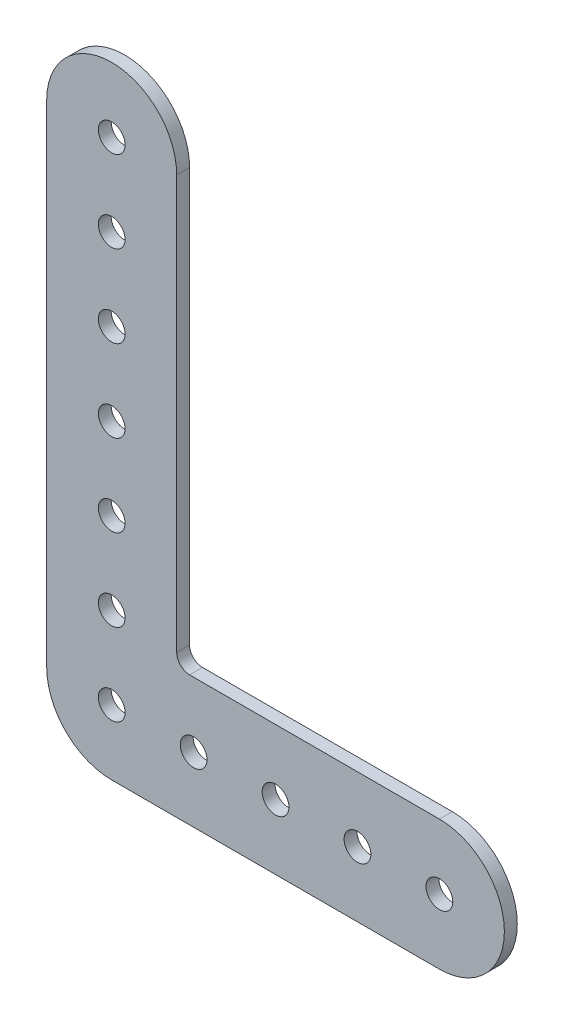
from build123d import *

# Parameters (mm, degrees)
SKETCH1_R           = 2.075
BOSS_EXTRUDE1_DEPTH = 1
FILLET1_R           = 2


with BuildPart() as part:
    # Sketch1 → Boss-Extrude1 (new, symmetric)
    with BuildSketch(Plane.XY):
        with BuildLine():
            Line((-10.075, 76.2), (-10.075, 0))
            ThreePointArc((-10.075, 0), (-7.12410082, -7.12410082), (0, -10.075))
            Line((0, -10.075), (50.8, -10.075))
            ThreePointArc((50.8, -10.075), (60.875, 0), (50.8, 10.075))
            Line((50.8, 10.075), (10.075, 10.075))
            Line((10.075, 10.075), (10.075, 76.2))
            ThreePointArc((10.075, 76.2), (0, 86.275), (-10.075, 76.2))
        make_face()
        Circle(SKETCH1_R, mode=Mode.SUBTRACT)
        with Locations((12.7, 0)):
            Circle(SKETCH1_R, mode=Mode.SUBTRACT)
        with Locations((25.4, 0)):
            Circle(SKETCH1_R, mode=Mode.SUBTRACT)
        with Locations((38.1, 0)):
            Circle(SKETCH1_R, mode=Mode.SUBTRACT)
        with Locations((50.8, 0)):
            Circle(SKETCH1_R, mode=Mode.SUBTRACT)
        with Locations((0, 12.7)):
            Circle(SKETCH1_R, mode=Mode.SUBTRACT)
        with Locations((0, 25.4)):
            Circle(SKETCH1_R, mode=Mode.SUBTRACT)
        with Locations((0, 38.1)):
            Circle(SKETCH1_R, mode=Mode.SUBTRACT)
        with Locations((0, 50.8)):
            Circle(SKETCH1_R, mode=Mode.SUBTRACT)
        with Locations((0, 63.5)):
            Circle(SKETCH1_R, mode=Mode.SUBTRACT)
        with Locations((0, 76.2)):
            Circle(SKETCH1_R, mode=Mode.SUBTRACT)
    extrude(amount=BOSS_EXTRUDE1_DEPTH, both=True)

    # Fillet1
    fillet1_edges = [part.edges().sort_by_distance(p)[0] for p in [
        (10.075, 10.075, 0),
    ]]
    fillet(fillet1_edges, radius=FILLET1_R)


solid = part.part
